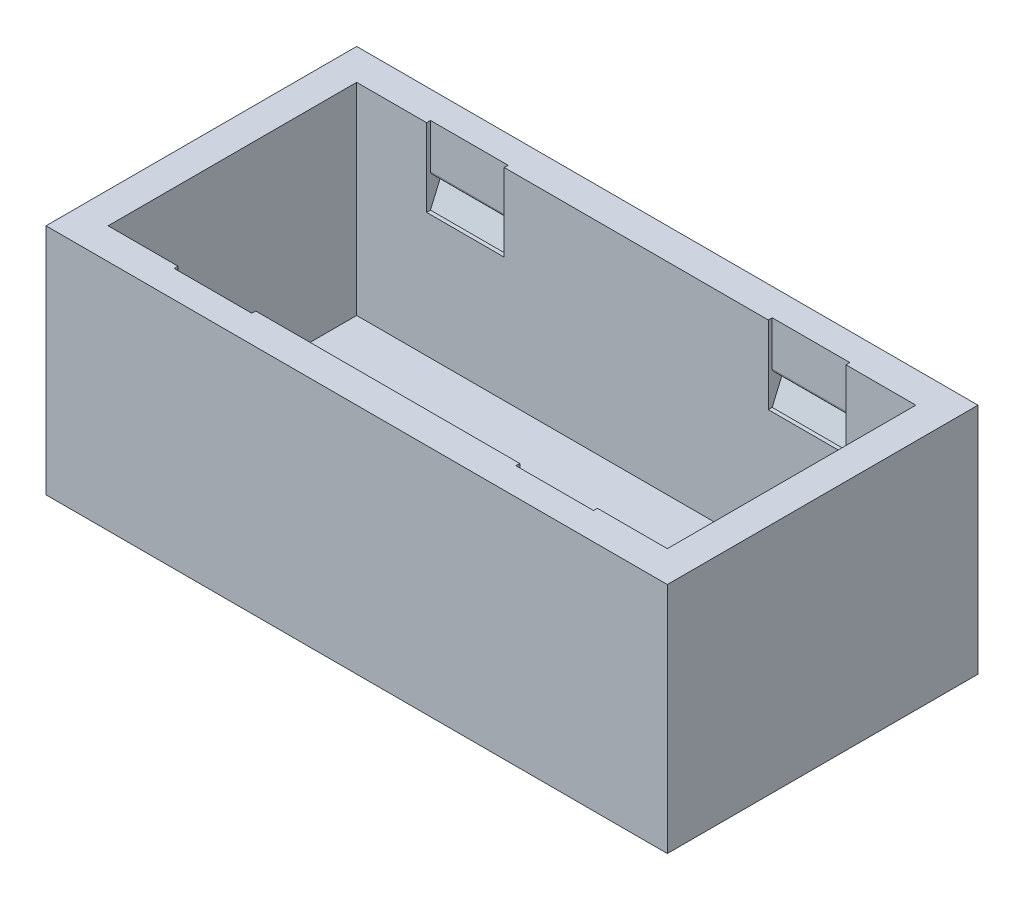
from build123d import *

# Parameters (mm, degrees)
SKETCH1_W            = 40
SKETCH1_H            = 20
BOSS_EXTRUDE1_DEPTH  = 15
SHELL2_T             = -2
CUT_EXTRUDE1_START   = -11
CUT_EXTRUDE1_DEPTH   = 2.5
MIRROR2_START        = -11
MIRROR2_COPY_1_DEPTH = 2.5


with BuildPart() as part:
    # Sketch1 → Boss-Extrude1 (new body)
    with BuildSketch(Plane(origin=(0, 0, 0), x_dir=(1, 0, 0), z_dir=(0, 1, 0))):
        Rectangle(SKETCH1_W, SKETCH1_H)
    extrude(amount=BOSS_EXTRUDE1_DEPTH)

    # Shell2
    shell2_openings = [part.faces().sort_by_distance(p)[0] for p in [
        (0, 15, 0),
    ]]
    offset(amount=SHELL2_T, openings=shell2_openings, kind=Kind.INTERSECTION)

    # Sketch2 → Cut-Extrude1 (cut, symmetric)
    with BuildSketch(Plane(origin=(0, 0, 0), x_dir=(0, 0, -1), z_dir=(1, 0, 0)).offset(CUT_EXTRUDE1_START)):
        with BuildLine():
            Line((8.25, 15), (8.25, 12.144151844))
            ThreePointArc((8.25, 12.144151844), (8.287751563, 12.027209787), (8.386754447, 11.954415184))
            Line((8.386754447, 11.954415184), (9, 11.75))
            Line((9, 11.75), (8.25, 10))
            Line((8.25, 10), (7.25, 10))
            Line((7.25, 10), (7.25, 15))
            Line((7.25, 15), (8.25, 15))
        make_face()
    cut_extrude1 = extrude(amount=CUT_EXTRUDE1_DEPTH, both=True, mode=Mode.SUBTRACT)

    # Mirror1: Cut-Extrude1 across plane
    add(cut_extrude1.mirror(Plane(origin=(0, 0, 0), x_dir=(0, 0, 1), z_dir=(1, 0, 0))), mode=Mode.SUBTRACT)

    # Mirror2: Cut-Extrude1 across plane
    add(cut_extrude1.mirror(Plane.XY), mode=Mode.SUBTRACT)

    # Mirror2 copy 1 sketch → Mirror2 copy 1 (cut, symmetric)
    with BuildSketch(Plane.ZY.offset(MIRROR2_START)):
        with BuildLine():
            Line((8.25, 15), (8.25, 12.144151844))
            ThreePointArc((8.25, 12.144151844), (8.287751563, 12.027209787), (8.386754447, 11.954415184))
            Line((8.386754447, 11.954415184), (9, 11.75))
            Line((9, 11.75), (8.25, 10))
            Line((8.25, 10), (7.25, 10))
            Line((7.25, 10), (7.25, 15))
            Line((7.25, 15), (8.25, 15))
        make_face()
    extrude(amount=MIRROR2_COPY_1_DEPTH, both=True, mode=Mode.SUBTRACT)


solid = part.part
